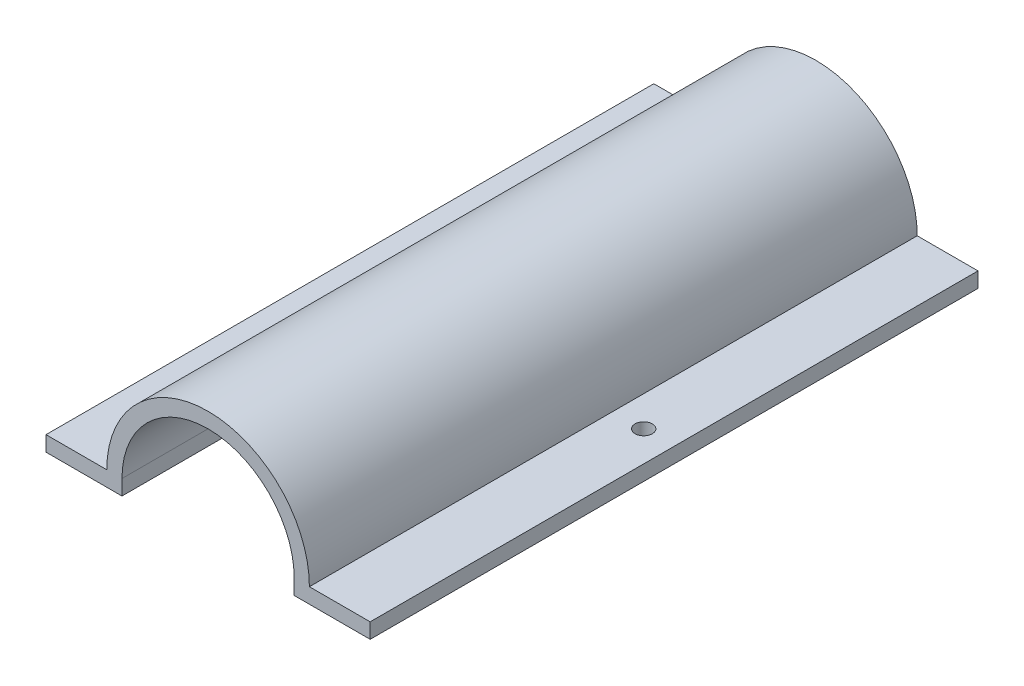
from build123d import *

# Parameters (mm, degrees)
AUFSATZ_LINEAR_AUSTRAGEN1_DEPTH      = 120
F_3_4_3_4_DURCHMESSER_BOHRUNG1_D     = 3.4
F_3_4_3_4_DURCHMESSER_BOHRUNG1_DEPTH = 5
F_3_4_3_4_DURCHMESSER_BOHRUNG1_TIP   = 1.021463052


with BuildPart() as part:
    # Skizze1 → Aufsatz-Linear austragen1 (new body)
    with BuildSketch(Plane.XY):
        with BuildLine():
            Line((0, 0), (15, 0))
            Line((15, 0), (15, 3))
            ThreePointArc((15, 3), (32, 20), (49, 3))
            Line((49, 3), (49, 0))
            Line((49, 0), (64, 0))
            Line((64, 0), (64, 3))
            Line((64, 3), (52, 3))
            ThreePointArc((52, 3), (32, 23), (12, 3))
            Line((12, 3), (0, 3))
            Line((0, 3), (0, 0))
        make_face()
    extrude(amount=AUFSATZ_LINEAR_AUSTRAGEN1_DEPTH)

    # Ø3.4 (3.4) Durchmesser Bohrung1
    with Locations(Plane(origin=(0, 3, 0), x_dir=(1, 0, 0), z_dir=(0, 1, 0))):
        with Locations((58, -60), (6, -60)):
            Hole(F_3_4_3_4_DURCHMESSER_BOHRUNG1_D / 2, depth=F_3_4_3_4_DURCHMESSER_BOHRUNG1_DEPTH)
            with Locations((0, 0, -(F_3_4_3_4_DURCHMESSER_BOHRUNG1_DEPTH + F_3_4_3_4_DURCHMESSER_BOHRUNG1_TIP / 2))):  # 118° drill point
                Cone(0, F_3_4_3_4_DURCHMESSER_BOHRUNG1_D / 2, F_3_4_3_4_DURCHMESSER_BOHRUNG1_TIP, mode=Mode.SUBTRACT)


solid = part.part
